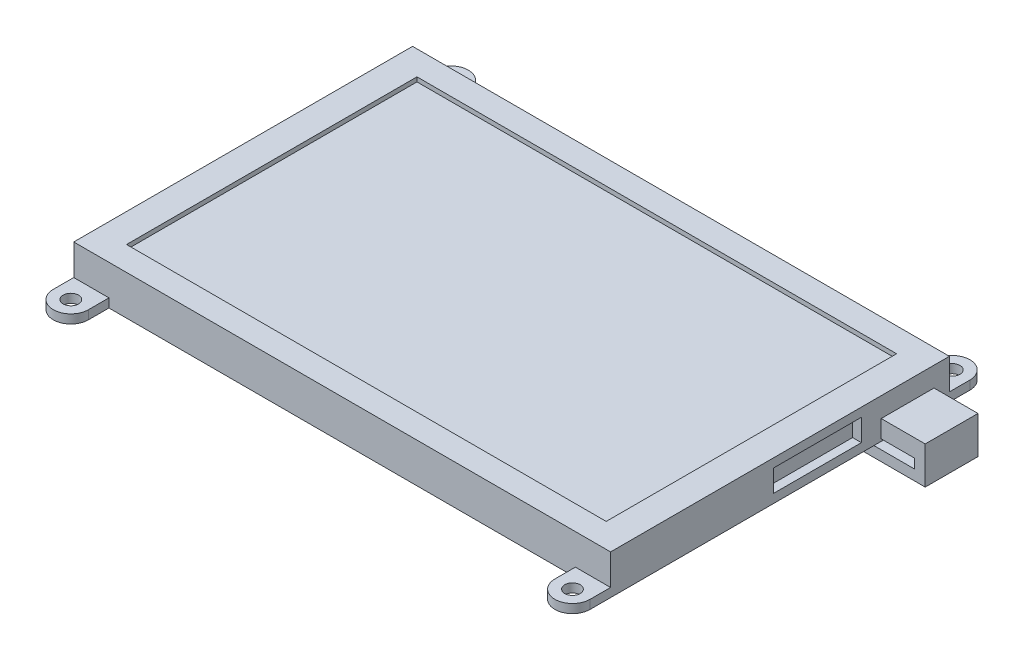
from build123d import *

# Parameters (mm, degrees)
SKETCH1_W           = 122
SKETCH1_H           = 77
BOSS_EXTRUDE1_DEPTH = 9
SKETCH2_W           = 109
SKETCH2_H           = 66
CUT_EXTRUDE1_DEPTH  = 1
BOSS_EXTRUDE2_DEPTH = 2
SKETCH4_R           = 1.75
CUT_EXTRUDE3_DEPTH  = 4
SKETCH5_W           = 12
SKETCH5_H           = 4
SKETCH5_W_2         = 20
SKETCH5_H_2         = 5
CUT_EXTRUDE4_DEPTH  = 2
SKETCH11_W          = 12
SKETCH11_H          = 4
BOSS_EXTRUDE4_DEPTH = 10
SKETCH12_W          = 2.415928069
SKETCH12_H          = 12
BOSS_EXTRUDE5_DEPTH = 4.5
SKETCH13_W          = 12
SKETCH13_H          = 2.350282926
BOSS_EXTRUDE6_DEPTH = 14
SKETCH11_2_W        = 12
SKETCH11_2_H        = 4
BOSS_EXTRUDE7_DEPTH = 14


with BuildPart() as part:
    # Sketch1 → Boss-Extrude1 (new body)
    with BuildSketch(Plane(origin=(0, 0, 0), x_dir=(1, 0, 0), z_dir=(0, 1, 0))):
        with Locations((61, 38.5)):
            Rectangle(SKETCH1_W, SKETCH1_H)
    extrude(amount=BOSS_EXTRUDE1_DEPTH)

    # Sketch2 → Cut-Extrude1 (cut)
    with BuildSketch(Plane(origin=(0, 9, 0), x_dir=(1, 0, 0), z_dir=(0, 1, 0))):
        with Locations((61, 38.5)):
            Rectangle(SKETCH2_W, SKETCH2_H)
    extrude(amount=-CUT_EXTRUDE1_DEPTH, mode=Mode.SUBTRACT)

    # Sketch3 → Boss-Extrude2 (add)
    with BuildSketch(Plane.XZ):
        with BuildLine():
            Line((0, -81.66), (0, -72.34))
            ThreePointArc((0, -72.34), (4, -68.34), (8, -72.34))
            Line((8, -72.34), (8, -81.66))
            ThreePointArc((8, -81.66), (4, -85.66), (0, -81.66))
        make_face()
        with BuildLine():
            Line((122, -81.66), (122, -72.34))
            ThreePointArc((122, -72.34), (118, -68.34), (114, -72.34))
            Line((114, -72.34), (114, -81.66))
            ThreePointArc((114, -81.66), (118, -85.66), (122, -81.66))
        make_face()
        with BuildLine():
            Line((0, 4.66), (0, -4.66))
            ThreePointArc((0, -4.66), (4, -8.66), (8, -4.66))
            Line((8, -4.66), (8, 4.66))
            ThreePointArc((8, 4.66), (4, 8.66), (0, 4.66))
        make_face()
        with BuildLine():
            Line((122, 4.66), (122, -4.66))
            ThreePointArc((122, -4.66), (118, -8.66), (114, -4.66))
            Line((114, -4.66), (114, 4.66))
            ThreePointArc((114, 4.66), (118, 8.66), (122, 4.66))
        make_face()
    extrude(amount=-BOSS_EXTRUDE2_DEPTH)

    # Sketch4 → Cut-Extrude3 (cut)
    with BuildSketch(Plane.XZ):
        with Locations((4, -81.66)):
            Circle(SKETCH4_R)
        with Locations((118, -81.66)):
            Circle(SKETCH4_R)
        with Locations((4, 4.66)):
            Circle(SKETCH4_R)
        with Locations((118, 4.66)):
            Circle(SKETCH4_R)
    extrude(amount=-CUT_EXTRUDE3_DEPTH, mode=Mode.SUBTRACT)

    # Sketch5 → Cut-Extrude4 (cut)
    with BuildSketch(Plane(origin=(122, 0, 0), x_dir=(0, 0, -1), z_dir=(1, 0, 0))):
        with Locations((67.5, 2.5)):
            Rectangle(SKETCH5_W, SKETCH5_H)
        with Locations((47, 4.5)):
            Rectangle(SKETCH5_W_2, SKETCH5_H_2)
    extrude(amount=-CUT_EXTRUDE4_DEPTH, mode=Mode.SUBTRACT)



with BuildPart() as body_2:
    # Sketch11 → Boss-Extrude4 (new body)
    with BuildSketch(Plane(origin=(122, 0, 0), x_dir=(0, 0, -1), z_dir=(1, 0, 0))):
        with Locations((67.5, 2.5)):
            Rectangle(SKETCH11_W, SKETCH11_H)
    extrude(amount=BOSS_EXTRUDE4_DEPTH)

    # Sketch12 → Boss-Extrude5 (add)
    with BuildSketch(Plane.XZ.offset(-0.5)):
        with Locations((130.792035966, -67.5)):
            Rectangle(SKETCH12_W, SKETCH12_H)
    extrude(amount=BOSS_EXTRUDE5_DEPTH)

    # Sketch13 → Boss-Extrude6 (add)
    with BuildSketch(Plane.ZY.offset(-129.584071931)):
        with Locations((-67.5, -2.824858537)):
            Rectangle(SKETCH13_W, SKETCH13_H)
    extrude(amount=BOSS_EXTRUDE6_DEPTH)


with BuildPart() as part_1:
    add(part.part)

    add(body_2.part)  # Boss-Extrude7 merges body 2
    # Sketch11<2> → Boss-Extrude7 (add)
    with BuildSketch(Plane(origin=(122, 0, 0), x_dir=(0, 0, -1), z_dir=(1, 0, 0))):
        with Locations((67.5, 2.5)):
            Rectangle(SKETCH11_2_W, SKETCH11_2_H)
    extrude(amount=-BOSS_EXTRUDE7_DEPTH)


solid = part_1.part
